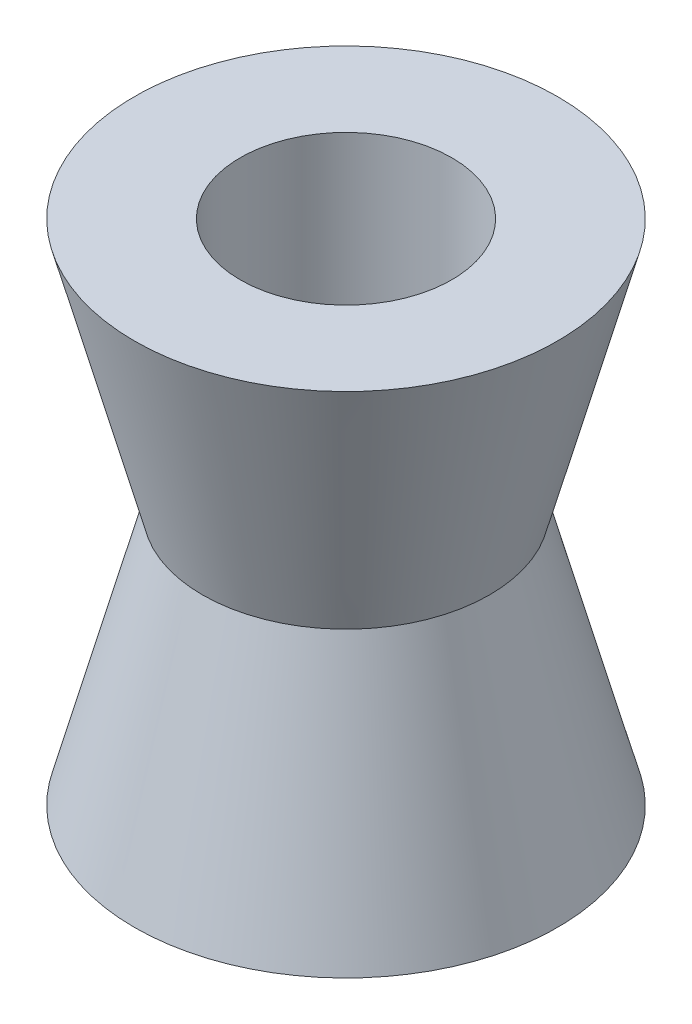
from build123d import *

# Parameters (mm, degrees)
SKETCH1_R               = 50
BOSS_EXTRUDE1_DEPTH     = 60
BOSS_EXTRUDE1_TAPER     = 15
CUT_EXTRUDE1_DEPTH      = 140.28388293
CUT_EXTRUDE1_DEPTH_BACK = 140.28388293
SKETCH2_R               = 25


with BuildPart() as part:
    # Sketch1 → Boss-Extrude1 (new body)
    with BuildSketch(Plane(origin=(0, 0, 0), x_dir=(1, 0, 0), z_dir=(0, 1, 0))):
        Circle(SKETCH1_R)
    boss_extrude1 = extrude(amount=BOSS_EXTRUDE1_DEPTH, taper=BOSS_EXTRUDE1_TAPER)

    # Mirror2: Boss-Extrude1 across plane
    add(boss_extrude1.mirror(Plane.ZX.offset(60)))

    # Sketch2 → Cut-Extrude1 (cut, two sides: drawn at the far end of the back side and taken through both)
    with BuildSketch(Plane(origin=(0, 120, 0), x_dir=(1, 0, 0), z_dir=(0, 1, 0)).offset(-CUT_EXTRUDE1_DEPTH_BACK)):
        with Locations(Location((0, 0, 0), (0, 0, 270))):
            Circle(SKETCH2_R)
    extrude(amount=CUT_EXTRUDE1_DEPTH + CUT_EXTRUDE1_DEPTH_BACK, mode=Mode.SUBTRACT)


solid = part.part
